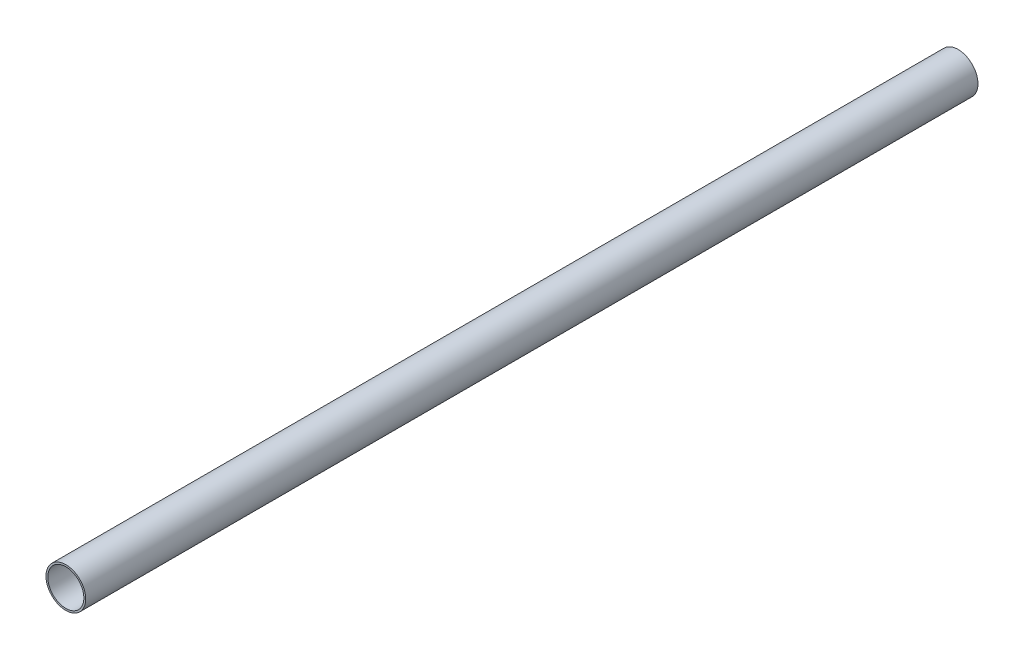
from build123d import *

# Parameters (mm, degrees)
SKETCH1_R           = 3.8862
SKETCH1_R_2         = 3.5306
BOSS_EXTRUDE1_DEPTH = 174.625


with BuildPart() as part:
    # Sketch1 → Boss-Extrude1 (new body)
    with BuildSketch(Plane.XY):
        with Locations((2675.105839614, 3025.345964382)):
            Circle(SKETCH1_R)
        with Locations((2675.105839614, 3025.345964382)):
            Circle(SKETCH1_R_2, mode=Mode.SUBTRACT)
    extrude(amount=BOSS_EXTRUDE1_DEPTH)


solid = part.part
